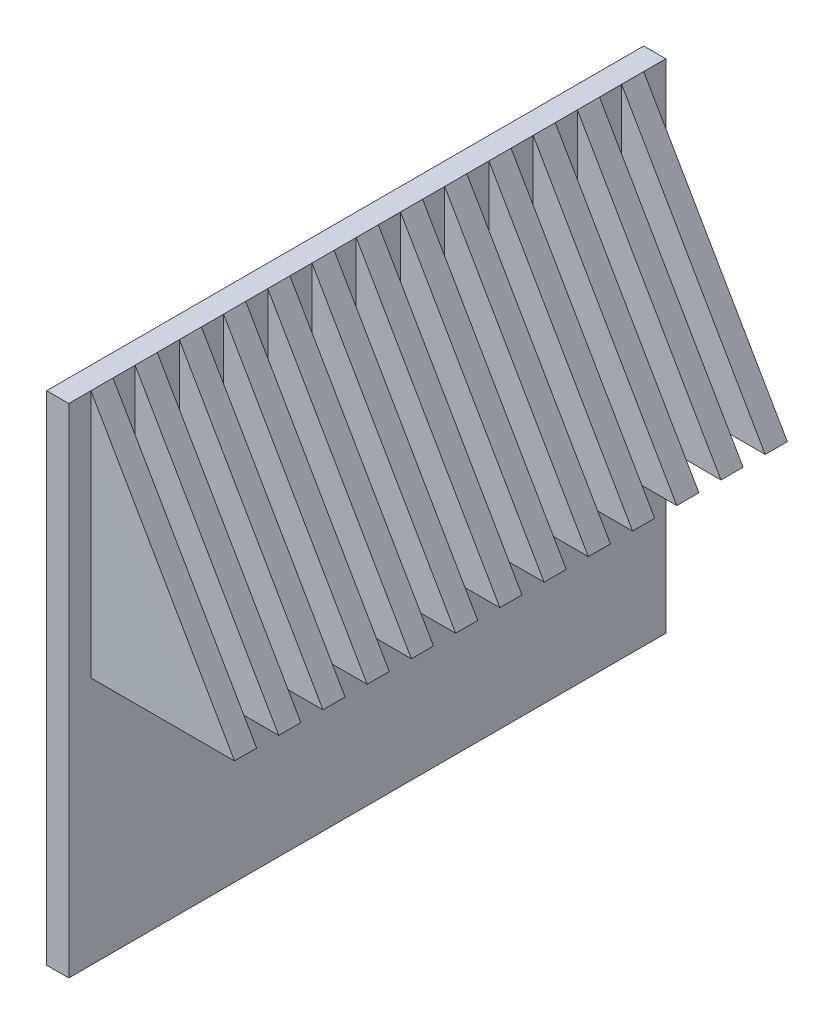
from build123d import *

# Parameters (mm, degrees)
SKETCH2_W           = 270
SKETCH2_H           = 225
BOSS_EXTRUDE1_DEPTH = 10
BOSS_EXTRUDE4_DEPTH = 270
SKETCH5_W           = 64.951905284
SKETCH5_H           = 10
CUT_EXTRUDE1_DEPTH  = 302.95039014
SKETCH6_W           = 64.951905284
SKETCH6_H           = 10
CUT_EXTRUDE2_DEPTH  = 302.95039014
SKETCH7_W           = 64.951905284
SKETCH7_H           = 10
CUT_EXTRUDE3_DEPTH  = 302.95039014


with BuildPart() as part:
    # Sketch2 → Boss-Extrude1 (new body)
    with BuildSketch(Plane(origin=(0, 0, 0), x_dir=(0, 0, -1), z_dir=(1, 0, 0))):
        with Locations((135, 112.5)):
            Rectangle(SKETCH2_W, SKETCH2_H)
    extrude(amount=BOSS_EXTRUDE1_DEPTH)

    # Sketch4 → Boss-Extrude4 (add)
    with BuildSketch(Plane.XY):
        Polygon((10, 225), (74.951905284, 112.5), (10, 112.5), align=None)
    extrude(amount=-BOSS_EXTRUDE4_DEPTH)

    # Sketch5 → Cut-Extrude1 (cut, through all)
    with BuildSketch(Plane.XZ.offset(-112.5)):
        with Locations((42.475952642, -265)):
            Rectangle(SKETCH5_W, SKETCH5_H)
    extrude(amount=-CUT_EXTRUDE1_DEPTH, mode=Mode.SUBTRACT)

    # Sketch6 → Cut-Extrude2 (cut, through all)
    with BuildSketch(Plane.XZ.offset(-112.5)):
        with Locations((42.475952642, -245)):
            Rectangle(SKETCH6_W, SKETCH6_H)
    extrude(amount=-CUT_EXTRUDE2_DEPTH, mode=Mode.SUBTRACT)

    # Sketch7 → Cut-Extrude3 (cut, through all)
    with BuildSketch(Plane.XZ.offset(-112.5)):
        with Locations((42.475952642, -5)):
            Rectangle(SKETCH7_W, SKETCH7_H)
        with Locations((42.475952642, -25)):
            Rectangle(SKETCH7_W, SKETCH7_H)
        with Locations((42.475952642, -45)):
            Rectangle(SKETCH7_W, SKETCH7_H)
        with Locations((42.475952642, -65)):
            Rectangle(SKETCH7_W, SKETCH7_H)
        with Locations((42.475952642, -85)):
            Rectangle(SKETCH7_W, SKETCH7_H)
        with Locations((42.475952642, -105)):
            Rectangle(SKETCH7_W, SKETCH7_H)
        with Locations((42.475952642, -125)):
            Rectangle(SKETCH7_W, SKETCH7_H)
        with Locations((42.475952642, -145)):
            Rectangle(SKETCH7_W, SKETCH7_H)
        with Locations((42.475952642, -165)):
            Rectangle(SKETCH7_W, SKETCH7_H)
        with Locations((42.475952642, -185)):
            Rectangle(SKETCH7_W, SKETCH7_H)
        with Locations((42.475952642, -205)):
            Rectangle(SKETCH7_W, SKETCH7_H)
        with Locations((42.475952642, -225)):
            Rectangle(SKETCH7_W, SKETCH7_H)
    extrude(amount=-CUT_EXTRUDE3_DEPTH, mode=Mode.SUBTRACT)


solid = part.part
